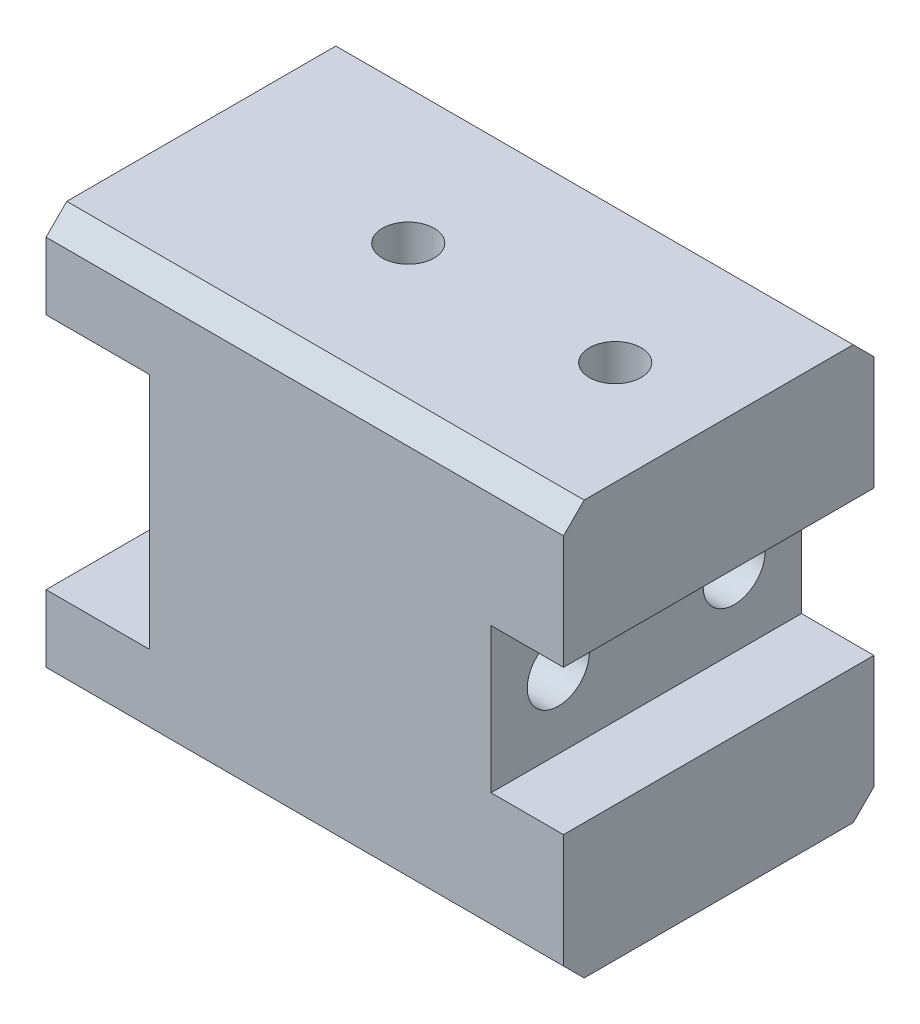
from build123d import *

# Parameters (mm, degrees)
SKETCH_1_W          = 15
SKETCH_1_H          = 20
EXTRUDE_1_DEPTH     = 25
SKETCH_2_W          = 15
SKETCH_2_H          = 11.5
CUT_EXTRUDE_1_DEPTH = 5
SKETCH_3_R          = 1.5
CUT_EXTRUDE_2_DEPTH = 24.58495283
SKETCH_4_R          = 1.25
CUT_EXTRUDE_3_DEPTH = 33.882366095
CHAMFER_1_SIZE      = 1
SKETCH_5_W          = 15
SKETCH_5_H          = 7
CUT_EXTRUDE_4_DEPTH = 3.5


with BuildPart() as part:
    # 草图1 → 凸台-拉伸1 (new body)
    with BuildSketch(Plane(origin=(0, 0, 0), x_dir=(0, 0, -1), z_dir=(1, 0, 0))):
        Rectangle(SKETCH_1_W, SKETCH_1_H)
    extrude(amount=EXTRUDE_1_DEPTH)

    # 草图2 → 切除-拉伸1 (cut)
    with BuildSketch(Plane.ZY):
        Rectangle(SKETCH_2_W, SKETCH_2_H)
    extrude(amount=-CUT_EXTRUDE_1_DEPTH, mode=Mode.SUBTRACT)

    # 草图3 → 切除-拉伸2 (cut, through all)
    with BuildSketch(Plane.ZY.offset(-5)):
        with Locations((-4.25, 0)):
            Circle(SKETCH_3_R)
        with Locations((4.25, 0)):
            Circle(SKETCH_3_R)
    extrude(amount=-CUT_EXTRUDE_2_DEPTH, mode=Mode.SUBTRACT)

    # 草图4 → 切除-拉伸3 (cut, through all)
    with BuildSketch(Plane(origin=(0, 10, 0), x_dir=(1, 0, 0), z_dir=(0, 1, 0))):
        with Locations(Location((20, 0, 0), (0, 0, 270))):
            Circle(SKETCH_4_R)
        with Locations(Location((10, 0, 0), (0, 0, 270))):
            Circle(SKETCH_4_R)
    extrude(amount=-CUT_EXTRUDE_3_DEPTH, mode=Mode.SUBTRACT)

    # 倒角1
    chamfer_1_edges = [part.edges().sort_by_distance(p)[0] for p in [
        (12.5, 10, 7.5),
        (12.5, 10, -7.5),
        (12.5, -10, -7.5),
        (12.5, -10, 7.5),
    ]]
    chamfer(chamfer_1_edges, length=CHAMFER_1_SIZE)

    # 草图5 → 切除-拉伸4 (cut)
    with BuildSketch(Plane(origin=(25, 0, 0), x_dir=(0, 0, -1), z_dir=(1, 0, 0))):
        Rectangle(SKETCH_5_W, SKETCH_5_H)
    extrude(amount=-CUT_EXTRUDE_4_DEPTH, mode=Mode.SUBTRACT)


solid = part.part
